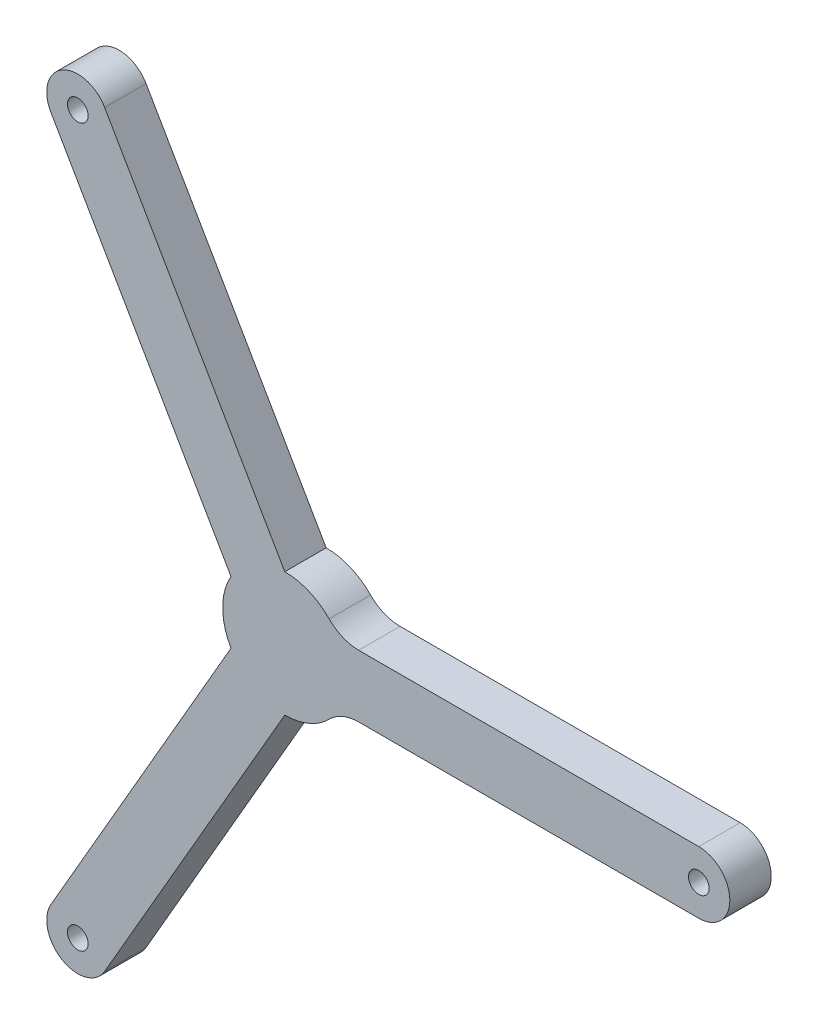
from build123d import *

# Parameters (mm, degrees)
SKETCH1_R           = 2.5
BOSS_EXTRUDE1_DEPTH = 10
FILLET1_R           = 10
CIRPATTERN1_COUNT   = 3


with BuildPart() as part:
    # Sketch1 → Boss-Extrude1 (new body)
    with BuildSketch(Plane.XY):
        with BuildLine():
            Line((100, 7.5), (12.990381057, 7.5))
            ThreePointArc((12.990381057, 7.5), (-15, 0), (12.990381057, -7.5))
            Line((12.990381057, -7.5), (100, -7.5))
            ThreePointArc((100, -7.5), (107.5, 0), (100, 7.5))
        make_face()
        with Locations((100, 0)):
            Circle(SKETCH1_R, mode=Mode.SUBTRACT)
    boss_extrude1 = extrude(amount=BOSS_EXTRUDE1_DEPTH)

    # Fillet1
    fillet1_edges = [part.edges().sort_by_distance(p)[0] for p in [
        (12.990381057, 7.5, 5),
        (12.990381057, -7.5, 5),
    ]]
    fillet(fillet1_edges, radius=FILLET1_R)

    # CirPattern1: Boss-Extrude1 ×3 about axis
    cirpattern1_axis = Axis((0, 0, 10), (0, 0, -1))
    for i in range(1, CIRPATTERN1_COUNT):
        add(boss_extrude1.rotate(cirpattern1_axis, i * 360 / CIRPATTERN1_COUNT))


solid = part.part
